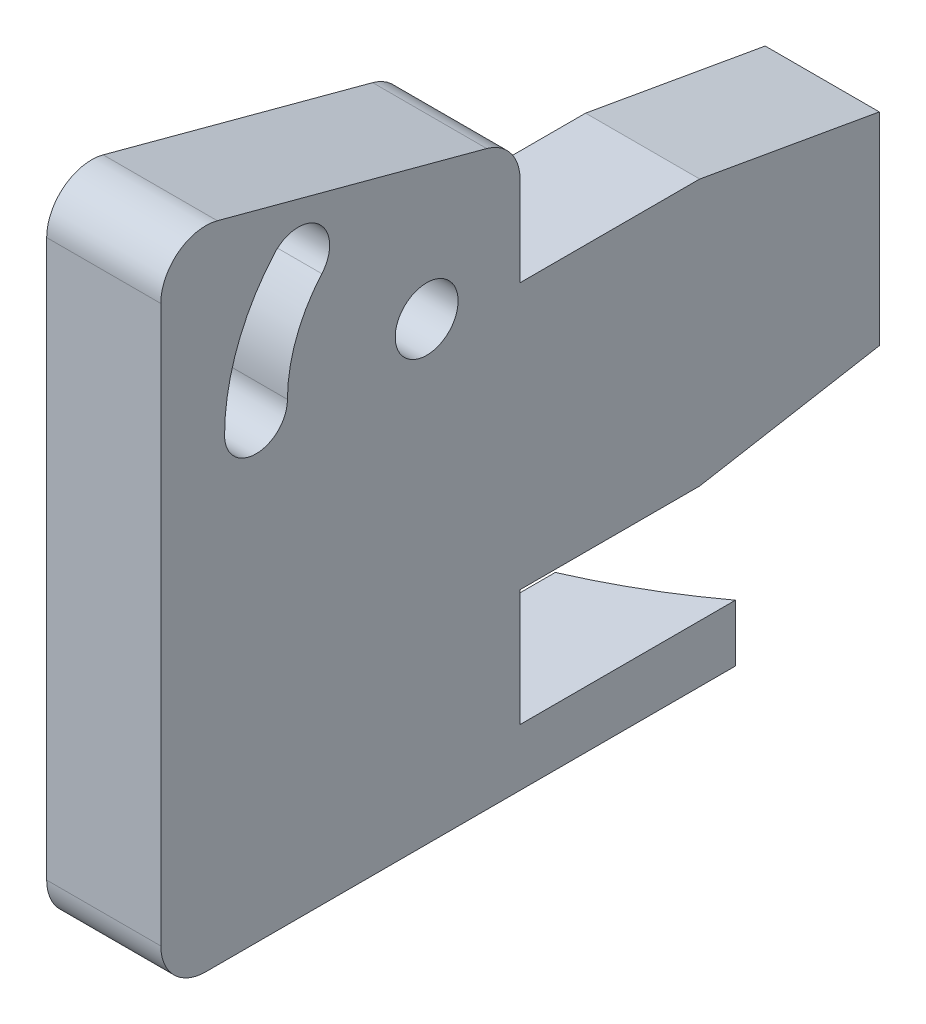
from build123d import *

# Parameters (mm, degrees)
BOSS_EXTRUDE1_DEPTH = 6.353
CUT_EXTRUDE1_REACH  = 30.604
SKETCH2_R           = 1.75
SKETCH3_R           = 32.5
CUT_EXTRUDE2_DEPTH  = 9.675
FILLET1_R           = 2.5
CHAMFER1_SIZE       = 10
CHAMFER1_SIZE2      = 1.763269807
CHAMFER2_SIZE       = 10
CHAMFER2_SIZE2      = 1.763269807


with BuildPart() as part:
    # Sketch1 → Boss-Extrude1 (new body)
    with BuildSketch(Plane(origin=(0, 0, 0), x_dir=(0, 0, -1), z_dir=(1, 0, 0))):
        Polygon((0, 19.4375), (-20, 19.4375), (-20, -19.4375), (20, -19.4375), (20, -16.2625), (0, -16.2625), (0, -9.7625), (20, -9.7625), (20, 5.0375), (0, 5.0375), (0, 11.5375), align=None)
    extrude(amount=BOSS_EXTRUDE1_DEPTH)

    # Sketch2 → Cut-Extrude1 (cut, up to next)
    with BuildSketch(Plane(origin=(6.353, 0, 0), x_dir=(0, 0, -1), z_dir=(1, 0, 0)), mode=Mode.PRIVATE) as cut_extrude1_sk1:
        with BuildLine():
            ThreePointArc((-16.45, 5.8875), (-14.7, 7.6375), (-12.95, 5.8875))
            ThreePointArc((-12.95, 5.8875), (-12.455196051, 8.612317472), (-11.033966385, 10.989199346))
            ThreePointArc((-11.033966385, 10.989199346), (-11.199317007, 13.458543221), (-13.668660882, 13.293192599))
            ThreePointArc((-13.668660882, 13.293192599), (-15.731736204, 9.842880202), (-16.45, 5.8875))
        make_face()
    cut_extrude1_tool1 = extrude(cut_extrude1_sk1.sketch, amount=-CUT_EXTRUDE1_REACH, mode=Mode.PRIVATE) & part.part
    # Sketch2 → Cut-Extrude1 (cut, up to next)
    with BuildSketch(Plane(origin=(6.353, 0, 0), x_dir=(0, 0, -1), z_dir=(1, 0, 0)), mode=Mode.PRIVATE) as cut_extrude1_sk2:
        with Locations((-14.7, 5.8875)):
            Circle(SKETCH2_R)
    cut_extrude1_tool2 = extrude(cut_extrude1_sk2.sketch, amount=-CUT_EXTRUDE1_REACH, mode=Mode.PRIVATE) & part.part
    # Sketch2 → Cut-Extrude1 (cut, up to next)
    with BuildSketch(Plane(origin=(6.353, 0, 0), x_dir=(0, 0, -1), z_dir=(1, 0, 0)), mode=Mode.PRIVATE) as cut_extrude1_sk3:
        with Locations((-5.2, 5.8875)):
            Circle(SKETCH2_R)
    cut_extrude1_tool3 = extrude(cut_extrude1_sk3.sketch, amount=-CUT_EXTRUDE1_REACH, mode=Mode.PRIVATE) & part.part
    # Sketch2 → Cut-Extrude1 (cut, up to next)
    with BuildSketch(Plane(origin=(6.353, 0, 0), x_dir=(0, 0, -1), z_dir=(1, 0, 0)), mode=Mode.PRIVATE) as cut_extrude1_sk4:
        Polygon((0, 19.4375), (-20, 19.4375), (-20, 17.296483849), (0, 11.9375), align=None)
    cut_extrude1_tool4 = extrude(cut_extrude1_sk4.sketch, amount=-CUT_EXTRUDE1_REACH, mode=Mode.PRIVATE) & part.part
    add(cut_extrude1_tool1.solids().sort_by_distance((6.353, 10.415401, 13.430466))[0], mode=Mode.SUBTRACT)
    add(cut_extrude1_tool2.solids().sort_by_distance((6.353, 5.8875, 14.7))[0], mode=Mode.SUBTRACT)
    add(cut_extrude1_tool3.solids().sort_by_distance((6.353, 5.8875, 5.2))[0], mode=Mode.SUBTRACT)
    add(cut_extrude1_tool4.solids().sort_by_distance((6.353, 16.779012, 8.147158))[0], mode=Mode.SUBTRACT)

    # Sketch3 → Cut-Extrude2 (cut)
    with BuildSketch(Plane.XZ.offset(19.4375)):
        with Locations((-13, -38.1)):
            Circle(SKETCH3_R)
    extrude(amount=-CUT_EXTRUDE2_DEPTH, mode=Mode.SUBTRACT)

    # Fillet1
    fillet1_edges = [part.edges().sort_by_distance(p)[0] for p in [
        (3.1765, -19.4375, 20),
        (3.1765, 17.296483849, 20),
        (3.1765, 11.9375, 0),
    ]]
    fillet(fillet1_edges, radius=FILLET1_R)

    # Chamfer1
    chamfer1_edges = [part.edges().sort_by_distance(p)[0] for p in [
        (3.1765, 5.0375, -20),
    ]]
    chamfer1_side = [part.faces().sort_by_distance(p)[0] for p in [
        (3.1765, 5.0375, -10),
    ]]
    chamfer(chamfer1_edges, length=CHAMFER1_SIZE, length2=CHAMFER1_SIZE2, reference=chamfer1_side[0])

    # Chamfer2
    chamfer2_edges = [part.edges().sort_by_distance(p)[0] for p in [
        (3.1765, -9.7625, -20),
    ]]
    chamfer2_side = [part.faces().sort_by_distance(p)[0] for p in [
        (3.1765, -9.7625, -10),
    ]]
    chamfer(chamfer2_edges, length=CHAMFER2_SIZE, length2=CHAMFER2_SIZE2, reference=chamfer2_side[0])


solid = part.part
